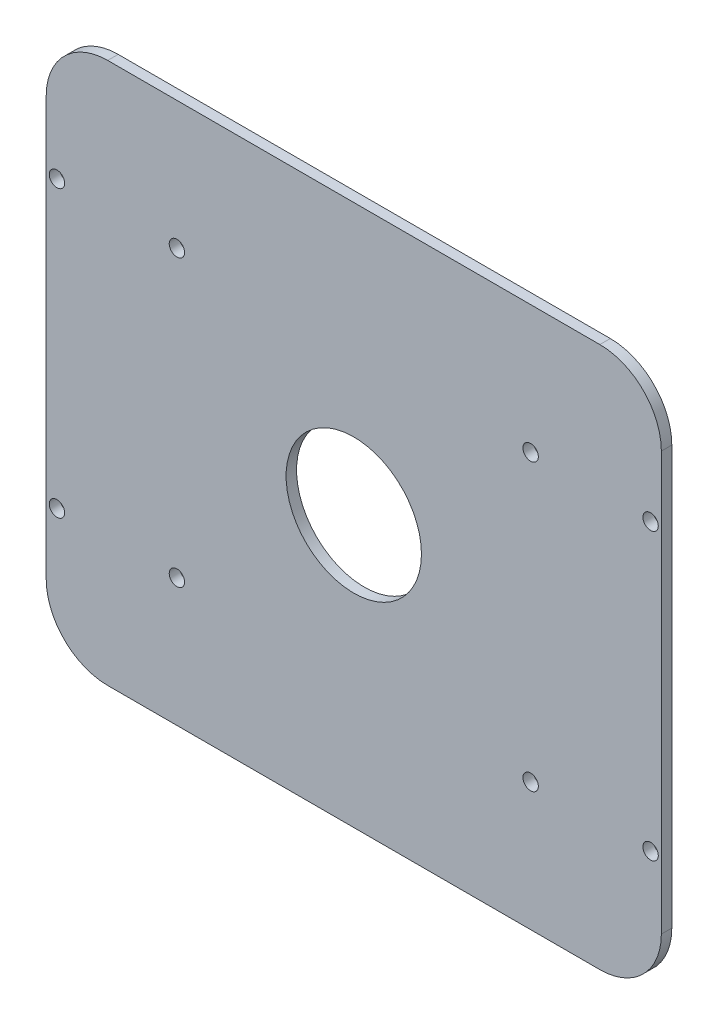
from build123d import *

# Parameters (mm, degrees)
SKETCH_1_W      = 100
SKETCH_1_H      = 88
SKETCH_1_R      = 1.25
SKETCH_1_R_2    = 11
EXTRUDE_1_DEPTH = 1.7
FILLET_1_R      = 10


with BuildPart() as part:
    # 草图1 → 凸台-拉伸1 (new body)
    with BuildSketch(Plane.XY):
        Rectangle(SKETCH_1_W, SKETCH_1_H)
        with Locations((-48.25, 23.2)):
            Circle(SKETCH_1_R, mode=Mode.SUBTRACT)
        with Locations((-48.25, -23.2)):
            Circle(SKETCH_1_R, mode=Mode.SUBTRACT)
        with Locations(Location((48.25, -23.2, 0), (0, 0, 180))):
            Circle(SKETCH_1_R, mode=Mode.SUBTRACT)
        with Locations(Location((48.25, 23.2, 0), (0, 0, 180))):
            Circle(SKETCH_1_R, mode=Mode.SUBTRACT)
        Circle(SKETCH_1_R_2, mode=Mode.SUBTRACT)
        with Locations((-28.75, 23.2)):
            Circle(SKETCH_1_R, mode=Mode.SUBTRACT)
        with Locations(Location((-28.75, -23.2, 0), (0, 0, 180))):
            Circle(SKETCH_1_R, mode=Mode.SUBTRACT)
        with Locations((28.75, -23.2)):
            Circle(SKETCH_1_R, mode=Mode.SUBTRACT)
        with Locations(Location((28.75, 23.2, 0), (0, 0, 180))):
            Circle(SKETCH_1_R, mode=Mode.SUBTRACT)
    extrude(amount=EXTRUDE_1_DEPTH)

    # 圆角1
    fillet_1_edges = [part.edges().sort_by_distance(p)[0] for p in [
        (50, -44, 0.85),
        (-50, -44, 0.85),
        (-50, 44, 0.85),
        (50, 44, 0.85),
    ]]
    fillet(fillet_1_edges, radius=FILLET_1_R)


solid = part.part
